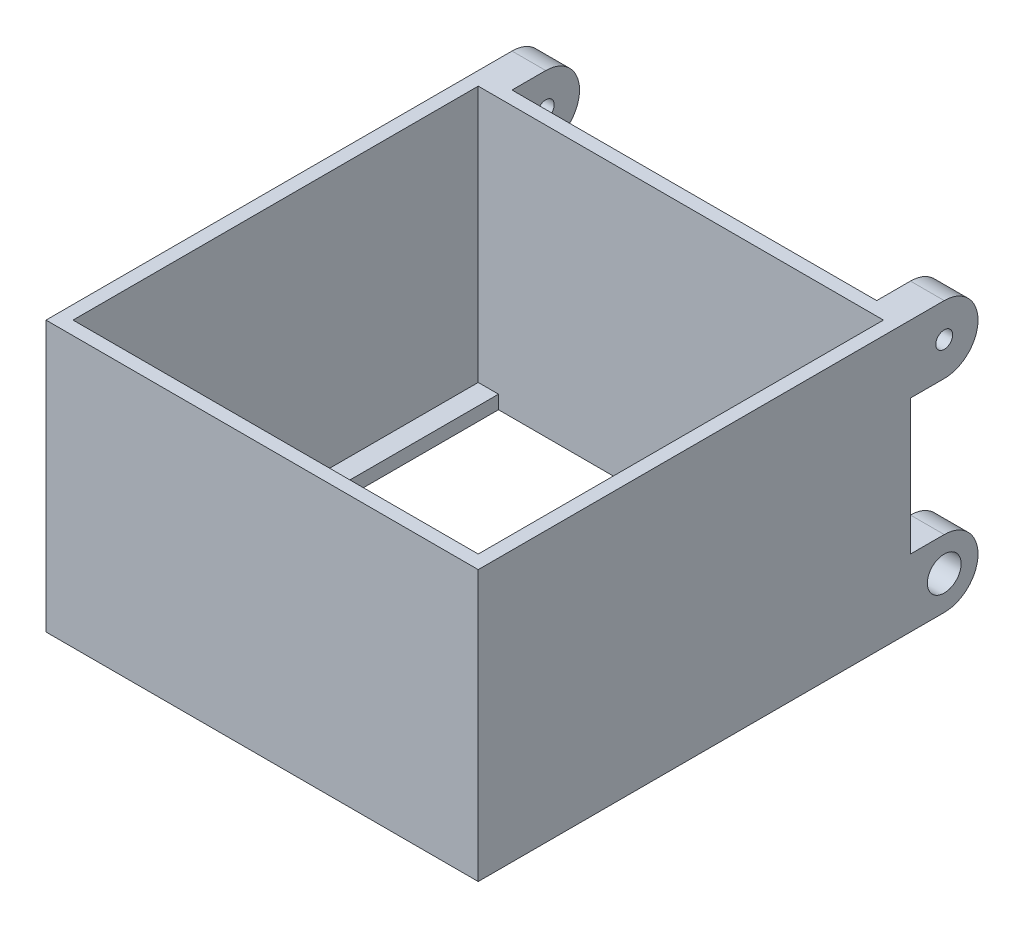
from build123d import *

# Parameters (mm, degrees)
SKETCH1_W           = 81.28
SKETCH1_H           = 81.28
SKETCH1_W_2         = 76.2
SKETCH1_H_2         = 76.2
BOSS_EXTRUDE1_DEPTH = 50.8
SKETCH2_W           = 3.81
SKETCH2_H           = 76.2
BOSS_EXTRUDE2_DEPTH = 2.54
SKETCH3_R           = 3.175
BOSS_EXTRUDE3_DEPTH = 6.35
SKETCH4_R           = 1.5875
BOSS_EXTRUDE4_DEPTH = 6.35


with BuildPart() as part:
    # Sketch1 → Boss-Extrude1 (new body)
    with BuildSketch(Plane(origin=(0, 0, 0), x_dir=(1, 0, 0), z_dir=(0, 1, 0))):
        Rectangle(SKETCH1_W, SKETCH1_H)
        Rectangle(SKETCH1_W_2, SKETCH1_H_2, mode=Mode.SUBTRACT)
    extrude(amount=BOSS_EXTRUDE1_DEPTH)

    # Sketch2 → Boss-Extrude2 (add)
    with BuildSketch(Plane(origin=(0, 0, 0), x_dir=(1, 0, 0), z_dir=(0, 1, 0))):
        with Locations((-36.195, 0)):
            Rectangle(SKETCH2_W, SKETCH2_H)
        with Locations((36.195, 0)):
            Rectangle(SKETCH2_W, SKETCH2_H)
    extrude(amount=BOSS_EXTRUDE2_DEPTH)

    # Sketch3 → Boss-Extrude3 (add)
    with BuildSketch(Plane(origin=(40.64, 0, 0), x_dir=(0, 0, -1), z_dir=(1, 0, 0))):
        with BuildLine():
            Line((46.99, 12.7), (40.64, 12.7))
            Line((40.64, 12.7), (40.64, 0))
            Line((40.64, 0), (46.99, 0))
            ThreePointArc((46.99, 0), (53.34, 6.35), (46.99, 12.7))
        make_face()
        with Locations((46.99, 6.35)):
            Circle(SKETCH3_R, mode=Mode.SUBTRACT)
    boss_extrude3 = extrude(amount=-BOSS_EXTRUDE3_DEPTH)

    # Sketch4 → Boss-Extrude4 (add)
    with BuildSketch(Plane(origin=(40.64, 0, 0), x_dir=(0, 0, -1), z_dir=(1, 0, 0))):
        with BuildLine():
            Line((46.99, 50.8), (40.64, 50.8))
            Line((40.64, 50.8), (40.64, 38.1))
            Line((40.64, 38.1), (46.99, 38.1))
            ThreePointArc((46.99, 38.1), (53.34, 44.45), (46.99, 50.8))
        make_face()
        with Locations((46.99, 44.45)):
            Circle(SKETCH4_R, mode=Mode.SUBTRACT)
    boss_extrude4 = extrude(amount=-BOSS_EXTRUDE4_DEPTH)

    # Mirror1: Boss-Extrude3, Boss-Extrude4 across plane
    add(boss_extrude3.mirror(Plane.ZY))
    add(boss_extrude4.mirror(Plane.ZY))


solid = part.part
